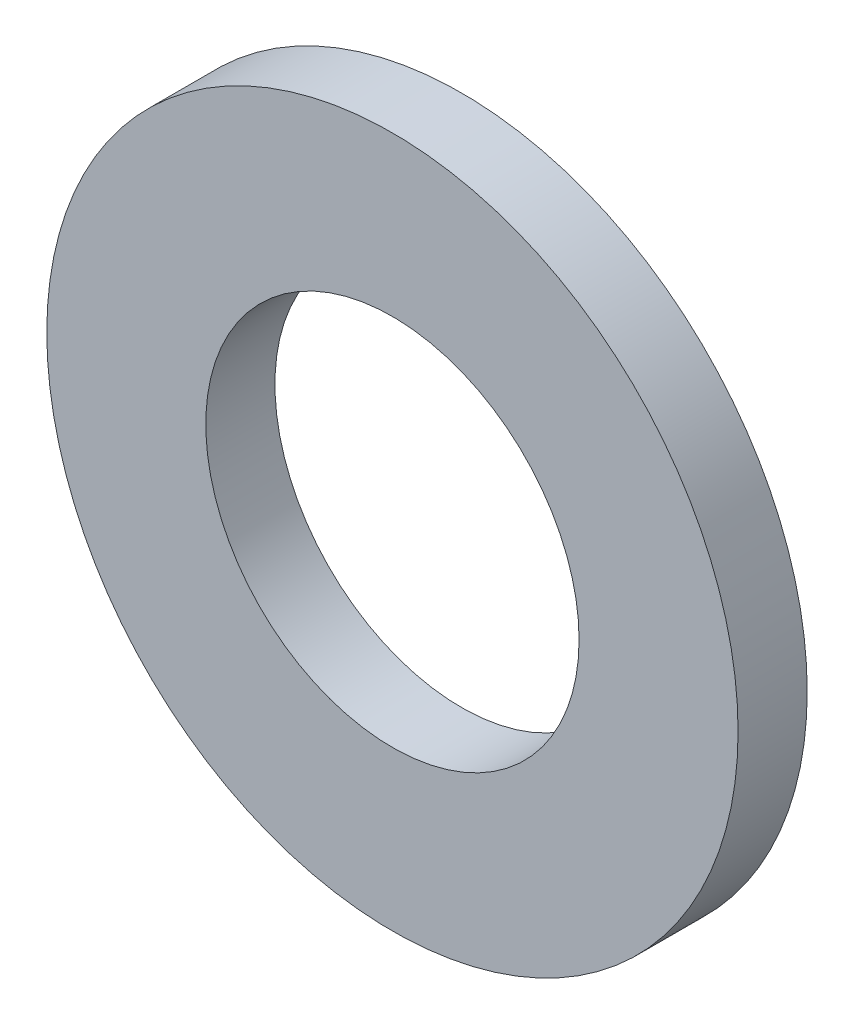
from build123d import *

# Parameters (mm, degrees)
WASHER_PROFILE_R   = 2.5
WASHER_PROFILE_R_2 = 1.35
WASHER_DEPTH       = 0.5


with BuildPart() as part:
    # Washer_profile → Washer (new body)
    with BuildSketch(Plane.XY):
        Circle(WASHER_PROFILE_R)
        Circle(WASHER_PROFILE_R_2, mode=Mode.SUBTRACT)
    extrude(amount=WASHER_DEPTH)


solid = part.part
